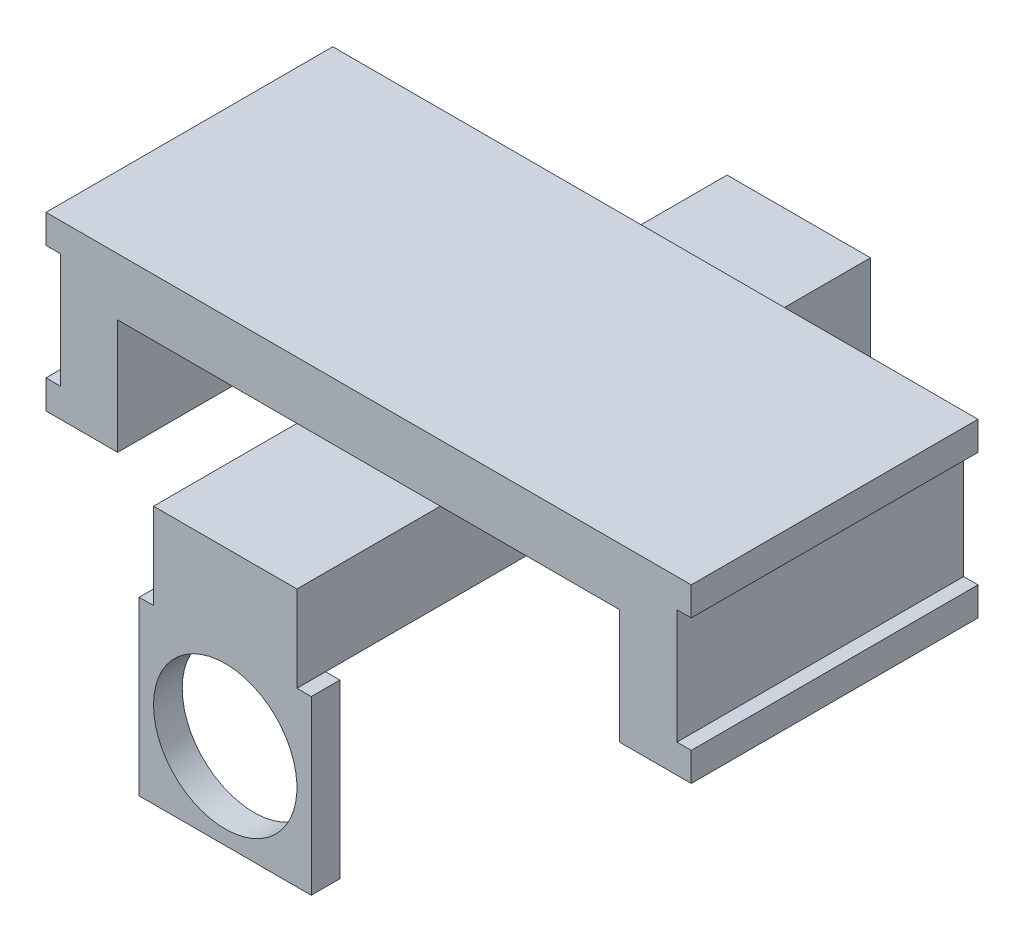
from build123d import *

# Parameters (mm, degrees)
SKETCH1_W           = 57.15
SKETCH1_H           = 25.4
BOSS_EXTRUDE1_DEPTH = 15.24
SKETCH2_W           = 44.45
SKETCH2_H           = 25.4
CUT_EXTRUDE1_DEPTH  = 10.16
SKETCH3_W           = 1.27
SKETCH3_H           = 10.16
CUT_EXTRUDE2_DEPTH  = 42.157602275
BOSS_EXTRUDE2_START = -10.16
SKETCH4_W           = 12.7
SKETCH4_H           = 50.8
BOSS_EXTRUDE2_DEPTH = 7.62
SKETCH6_W           = 15.24
SKETCH6_H           = 15.24
SKETCH6_R           = 6.35
BOSS_EXTRUDE3_DEPTH = 2.54


with BuildPart() as part:
    # Sketch1 → Boss-Extrude1 (new body)
    with BuildSketch(Plane(origin=(0, 0, 0), x_dir=(1, 0, 0), z_dir=(0, 1, 0))):
        Rectangle(SKETCH1_W, SKETCH1_H)
    extrude(amount=BOSS_EXTRUDE1_DEPTH)

    # Sketch2 → Cut-Extrude1 (cut)
    with BuildSketch(Plane.XZ):
        Rectangle(SKETCH2_W, SKETCH2_H)
    extrude(amount=-CUT_EXTRUDE1_DEPTH, mode=Mode.SUBTRACT)

    # Sketch3 → Cut-Extrude2 (cut, through all)
    with BuildSketch(Plane.XY.offset(12.7)):
        with Locations((-27.94, 7.62)):
            Rectangle(SKETCH3_W, SKETCH3_H)
        with Locations((27.94, 7.62)):
            Rectangle(SKETCH3_W, SKETCH3_H)
    extrude(amount=-CUT_EXTRUDE2_DEPTH, mode=Mode.SUBTRACT)

    # Sketch4 → Boss-Extrude2 (add)
    with BuildSketch(Plane.XZ.offset(BOSS_EXTRUDE2_START)):
        Rectangle(SKETCH4_W, SKETCH4_H)
    extrude(amount=BOSS_EXTRUDE2_DEPTH)

    # Sketch6 → Boss-Extrude3 (add)
    with BuildSketch(Plane(origin=(0, 0, -25.4), x_dir=(-1, 0, 0), z_dir=(0, 0, -1))):
        with Locations((0, -5.08)):
            Rectangle(SKETCH6_W, SKETCH6_H)
        with Locations((0, -5.08)):
            Circle(SKETCH6_R, mode=Mode.SUBTRACT)
    boss_extrude3 = extrude(amount=-BOSS_EXTRUDE3_DEPTH)

    # Mirror1: Boss-Extrude3 across plane
    add(boss_extrude3.mirror(Plane.XY))


solid = part.part
